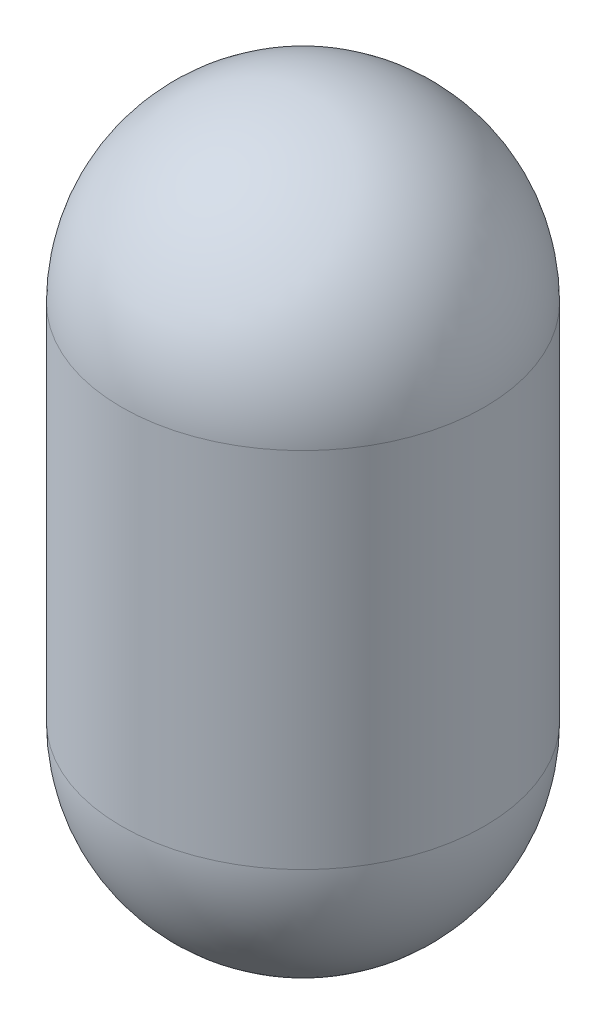
from build123d import *

# Parameters (mm, degrees)
SKETCH1_R           = 9.5
BOSS_EXTRUDE1_DEPTH = 38
FILLET1_R           = 9.5


with BuildPart() as part:
    # Sketch1 → Boss-Extrude1 (new body)
    with BuildSketch(Plane(origin=(0, 0, 0), x_dir=(1, 0, 0), z_dir=(0, 1, 0))):
        with Locations(Location((0, 0, 0), (0, 0, 270))):
            Circle(SKETCH1_R)
    extrude(amount=BOSS_EXTRUDE1_DEPTH)

    # Fillet1
    fillet1_edges = [part.edges().sort_by_distance(p)[0] for p in [
        (0, 0, -9.5),
        (0, 38, -9.5),
    ]]
    fillet(fillet1_edges, radius=FILLET1_R)


solid = part.part
